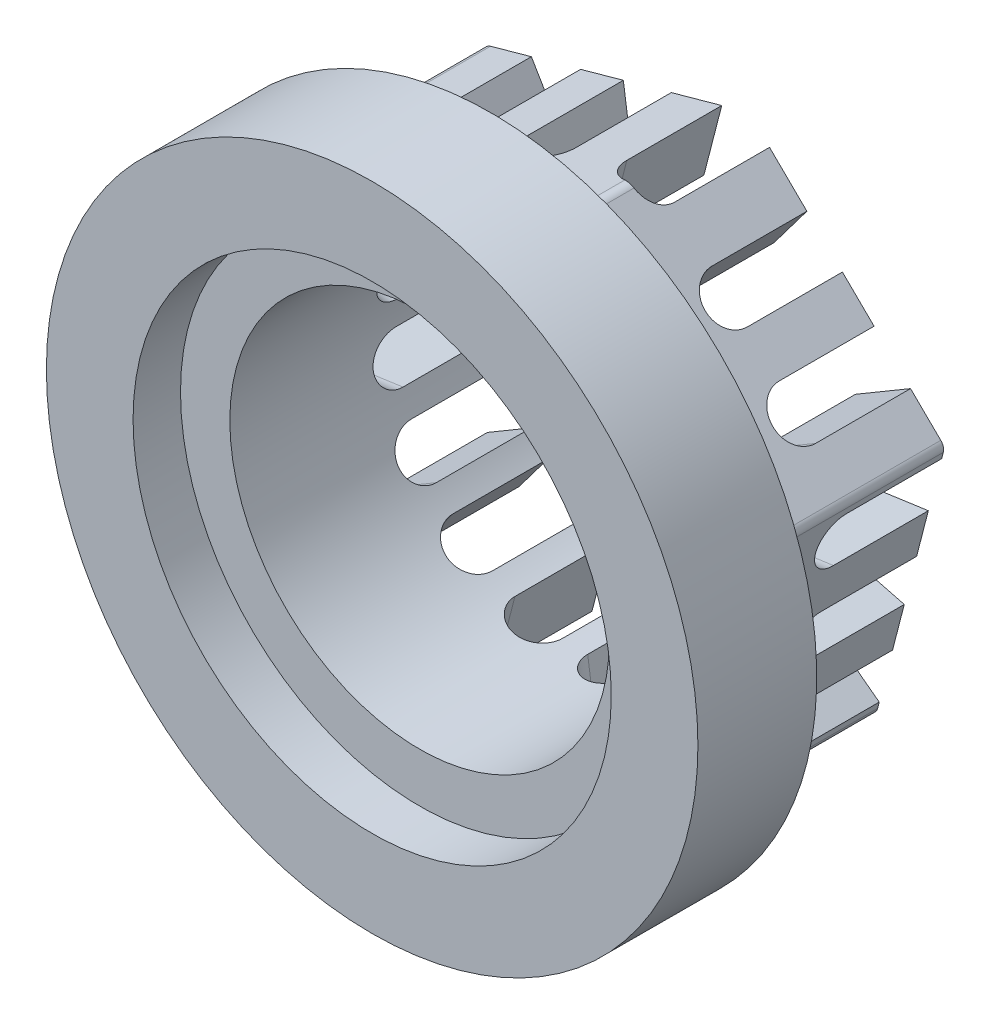
from build123d import *

# Parameters (mm, degrees)
SKETCH1_R           = 21.79955
BOSS_EXTRUDE1_DEPTH = 20.6502
SKETCH2_R           = 12.7
CUT_EXTRUDE1_DEPTH  = 20.6502
SKETCH3_R           = 16.000000004
CUT_EXTRUDE2_DEPTH  = 3.175
SKETCH4_OUTSIDE_W   = 58.604
SKETCH4_OUTSIDE_H   = 58.604
CUT_EXTRUDE3_DEPTH  = 12.7
CUT_EXTRUDE4_DEPTH  = 9.8552
CIRPATTERN1_COUNT   = 16
FILLET1_R           = 0.635


with BuildPart() as part:
    # Sketch1 → Boss-Extrude1 (new body)
    with BuildSketch(Plane.XY):
        Circle(SKETCH1_R)
    extrude(amount=BOSS_EXTRUDE1_DEPTH)

    # Sketch2 → Cut-Extrude1 (cut)
    with BuildSketch(Plane.XY.offset(20.6502)):
        Circle(SKETCH2_R)
    extrude(amount=-CUT_EXTRUDE1_DEPTH, mode=Mode.SUBTRACT)

    # Sketch3 → Cut-Extrude2 (cut)
    with BuildSketch(Plane.XY.offset(20.6502)):
        Circle(SKETCH3_R)
    extrude(amount=-CUT_EXTRUDE2_DEPTH, mode=Mode.SUBTRACT)

    # Sketch4 outside → Cut-Extrude3 (cut)
    with BuildSketch(Plane(origin=(0, 0, 0), x_dir=(-1, 0, 0), z_dir=(0, 0, -1))):
        Rectangle(SKETCH4_OUTSIDE_W, SKETCH4_OUTSIDE_H)
        Polygon((17.661795398, -4.907322758), (13.080763872, 12.841902112), (-4.581031526, 17.74922487), (-17.661795398, 4.907322758), (-13.080763872, -12.841902112), (4.581031526, -17.74922487), align=None, mode=Mode.SUBTRACT)
    extrude(amount=-CUT_EXTRUDE3_DEPTH, mode=Mode.SUBTRACT)

    # Sketch5 → Cut-Extrude4 (cut, symmetric)
    with BuildSketch(Plane(origin=(-15.371279635, 3.967289677, 0), x_dir=(0, 0, 1), z_dir=(-0.9682695833030739, 0.24990801117629627, 0))):
        with BuildLine():
            Line((6.35, 1.651), (0, 1.651))
            Line((0, 1.651), (0, -1.651))
            Line((0, -1.651), (6.35, -1.651))
            ThreePointArc((6.35, -1.651), (8.001, 0), (6.35, 1.651))
        make_face()
    cut_extrude4 = extrude(amount=CUT_EXTRUDE4_DEPTH, both=True, mode=Mode.SUBTRACT)

    # CirPattern1: Cut-Extrude4 ×16 about axis
    cirpattern1_axis = Axis((0, 0, 17.4752), (0, 0, 1))
    for i in range(1, CIRPATTERN1_COUNT):
        add(cut_extrude4.rotate(cirpattern1_axis, i * 360 / CIRPATTERN1_COUNT), mode=Mode.SUBTRACT)

    # Fillet1
    fillet1_edges = [part.edges().sort_by_distance(p)[0] for p in [
        (-17.661795398, -4.907322758, 6.35),
        (-13.080763872, 12.841902112, 6.35),
        (4.581031526, 17.74922487, 10.3505),
        (17.661795398, 4.907322758, 6.35),
        (13.080763872, -12.841902112, 6.35),
        (-4.581031526, -17.74922487, 10.3505),
    ]]
    fillet(fillet1_edges, radius=FILLET1_R)


solid = part.part
